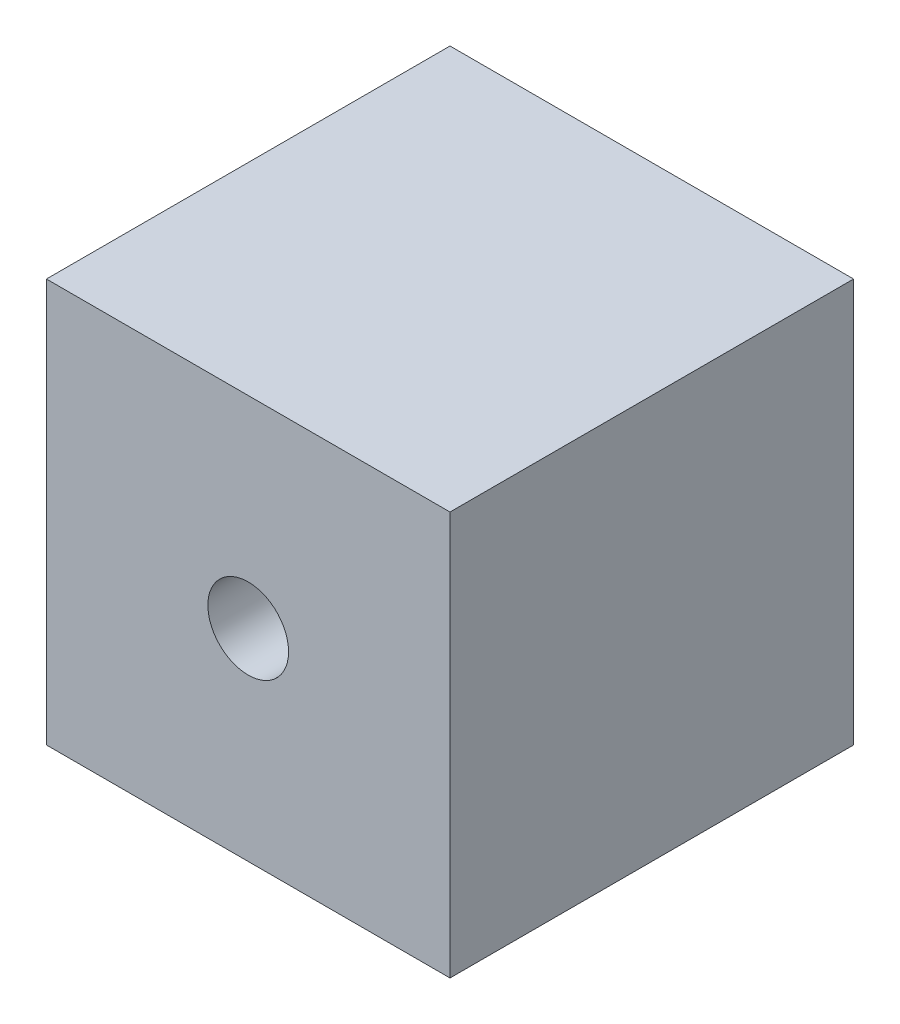
from build123d import *

# Parameters (mm, degrees)
ESQUISSE1_W             = 60
ESQUISSE1_H             = 60
BOSS_EXTRU_1_DEPTH      = 60
ESQUISSE2_R             = 6
ENL_V_MAT_EXTRU_1_DEPTH = 20
ESQUISSE3_R             = 6
ENL_V_MAT_EXTRU_2_DEPTH = 20


with BuildPart() as part:
    # Esquisse1 → Boss.-Extru.1 (new body)
    with BuildSketch(Plane(origin=(0, 0, 0), x_dir=(1, 0, 0), z_dir=(0, 1, 0))):
        with Locations((30, 30)):
            Rectangle(ESQUISSE1_W, ESQUISSE1_H)
    extrude(amount=BOSS_EXTRU_1_DEPTH)

    # Esquisse2 → Enlèv. mat.-Extru.1 (cut)
    with BuildSketch(Plane.XY):
        with Locations((30, 30)):
            Circle(ESQUISSE2_R)
    extrude(amount=-ENL_V_MAT_EXTRU_1_DEPTH, mode=Mode.SUBTRACT)

    # Esquisse3 → Enlèv. mat.-Extru.2 (cut)
    with BuildSketch(Plane.ZY):
        with Locations((-30, 30)):
            Circle(ESQUISSE3_R)
    extrude(amount=-ENL_V_MAT_EXTRU_2_DEPTH, mode=Mode.SUBTRACT)


solid = part.part
